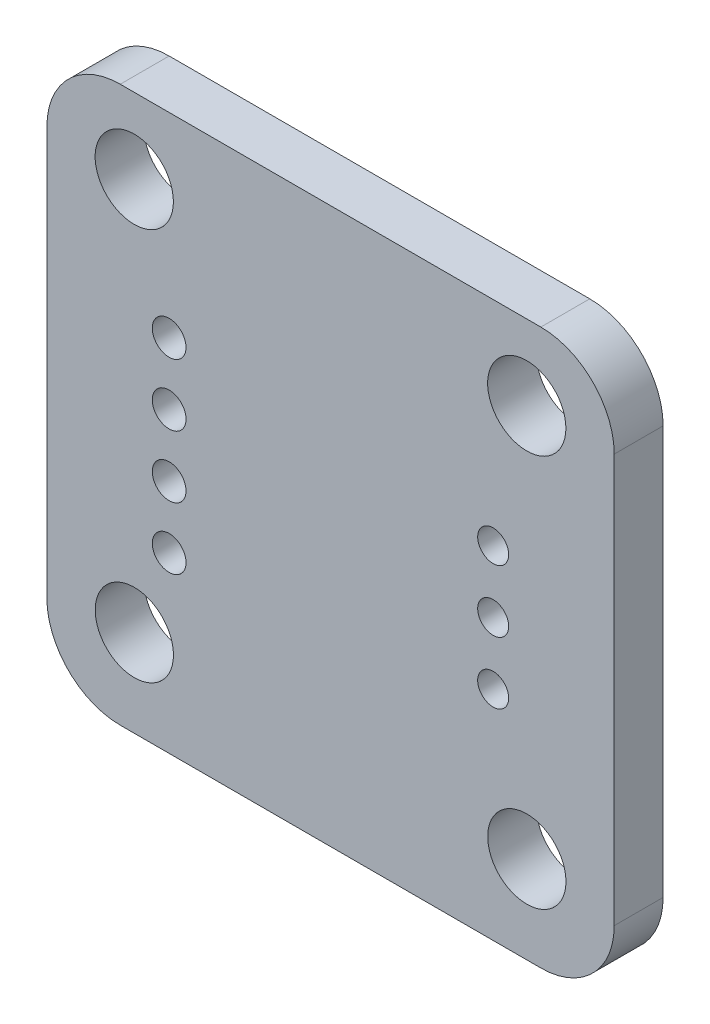
from build123d import *

# Parameters (mm, degrees)
SKETCH1_W           = 23.2
SKETCH1_H           = 22.7
SKETCH1_R           = 1.6
BOSS_EXTRUDE1_DEPTH = 2
FILLET1_R           = 3
SKETCH2_R           = 0.633596253
SKETCH2_R_2         = 0.690319611
CUT_EXTRUDE1_DEPTH  = 17.526342483


with BuildPart() as part:
    # Sketch1 → Boss-Extrude1 (new body)
    with BuildSketch(Plane.XY):
        with Locations((-0.002931945, -0.247067135)):
            Rectangle(SKETCH1_W, SKETCH1_H)
        with Locations((-8.029814258, 8.024213837)):
            Circle(SKETCH1_R, mode=Mode.SUBTRACT)
        with Locations((8.021282811, 8.026881394)):
            Circle(SKETCH1_R, mode=Mode.SUBTRACT)
        with Locations((8.023950367, -8.024215675)):
            Circle(SKETCH1_R, mode=Mode.SUBTRACT)
        with Locations((-8.027146702, -8.026883232)):
            Circle(SKETCH1_R, mode=Mode.SUBTRACT)
    extrude(amount=BOSS_EXTRUDE1_DEPTH)

    # Fillet1
    fillet1_edges = [part.edges().sort_by_distance(p)[0] for p in [
        (11.597068055, -11.597067135, 1),
        (-11.602931945, -11.597067135, 1),
        (-11.602931945, 11.102932865, 1),
        (11.597068055, 11.102932865, 1),
    ]]
    fillet(fillet1_edges, radius=FILLET1_R)

    # Sketch2 → Cut-Extrude1 (cut, through all)
    with BuildSketch(Plane.XY.offset(2)):
        with Locations((6.647068055, -2.697067135)):
            Circle(SKETCH2_R)
        with Locations((6.647068055, -0.157067135)):
            Circle(SKETCH2_R)
        with Locations((6.647068055, 2.382932865)):
            Circle(SKETCH2_R)
        with Locations((-6.602931945, -4.497067135)):
            Circle(SKETCH2_R_2)
        with Locations((-6.602931945, -1.957067135)):
            Circle(SKETCH2_R_2)
        with Locations((-6.602931945, 0.582932865)):
            Circle(SKETCH2_R_2)
        with Locations((-6.602931945, 3.122932865)):
            Circle(SKETCH2_R_2)
    extrude(amount=-CUT_EXTRUDE1_DEPTH, mode=Mode.SUBTRACT)


solid = part.part
